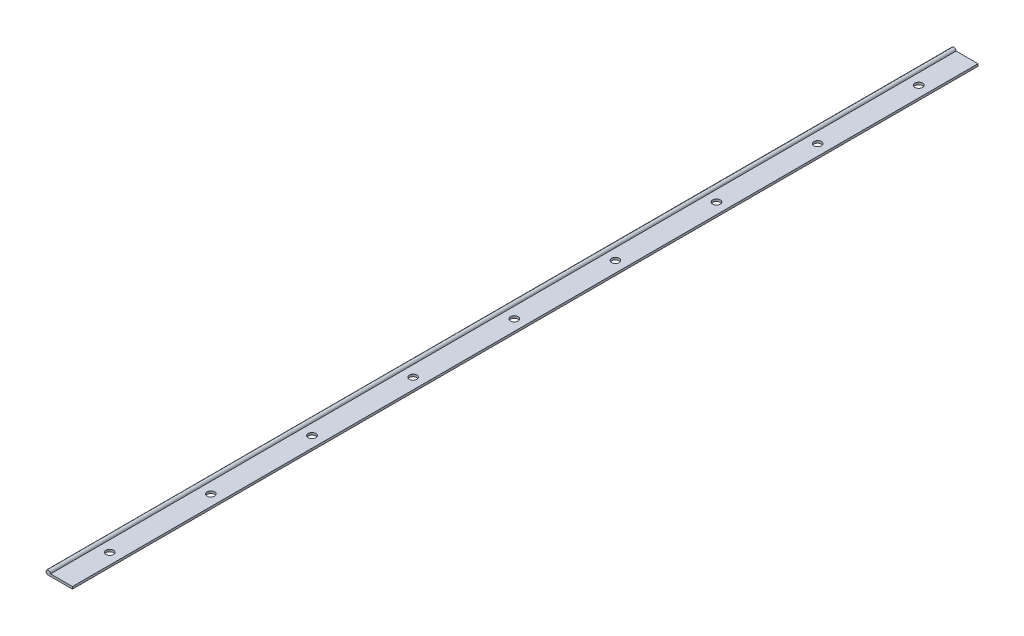
from build123d import *

# Parameters (mm, degrees)
BOSS_EXTRU_1_DEPTH         = 300
ESQUISSE2_R                = 2.5
ENL_V_MAT_EXTRU_1_DEPTH    = 301.430108345
R_P_TITION_LIN_AIRE1_COUNT = 9
R_P_TITION_LIN_AIRE1_PITCH = 67


with BuildPart() as part:
    # Esquisse1 → Boss.-Extru.1 (new, symmetric)
    with BuildSketch(Plane.XY):
        with BuildLine():
            Line((16, -1.5), (0, -1.5))
            ThreePointArc((0, -1.5), (-1.060660172, 1.060660172), (1.5, 0))
            Line((1.5, 0), (16, 0))
            Line((16, 0), (16, -1.5))
        make_face()
    extrude(amount=BOSS_EXTRU_1_DEPTH, both=True)

    # Esquisse2 → Enlèv. mat.-Extru.1 (cut, through all)
    with BuildSketch(Plane(origin=(0, 0, 0), x_dir=(1, 0, 0), z_dir=(0, 1, 0))):
        with Locations(Location((8.75, -268, 0), (0, 0, 180))):
            Circle(ESQUISSE2_R)
    enl_v_mat_extru_1 = extrude(amount=-ENL_V_MAT_EXTRU_1_DEPTH, mode=Mode.SUBTRACT)

    # Répétition linéaire1: Enlèv. mat.-Extru.1 ×9
    with Locations(*[(0, 0, -i * R_P_TITION_LIN_AIRE1_PITCH) for i in range(1, R_P_TITION_LIN_AIRE1_COUNT)]):
        add(enl_v_mat_extru_1, mode=Mode.SUBTRACT)


solid = part.part
